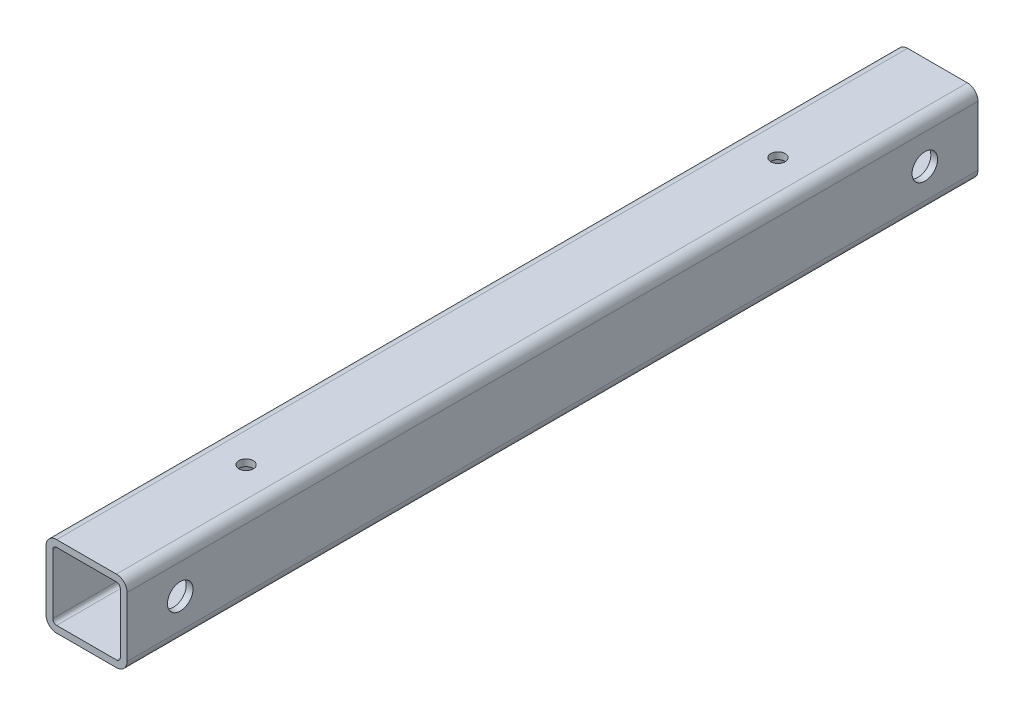
from build123d import *

# Parameters (mm, degrees)
BOSS_EXTRUDE1_DEPTH     = 400
CUT_EXTRUDE1_DEPTH      = 401.906229685
CUT_EXTRUDE1_DEPTH_BACK = 401.906229685
SKETCH2_R               = 6
CUT_EXTRUDE2_DEPTH      = 401.906229685
CUT_EXTRUDE2_DEPTH_BACK = 401.906229685
SKETCH3_R               = 3.38


with BuildPart() as part:
    # Sketch1 → Boss-Extrude1 (new body)
    with BuildSketch(Plane.XY):
        with BuildLine():
            Line((-14.05, 19.05), (14.05, 19.05))
            ThreePointArc((14.05, 19.05), (17.585533906, 17.585533906), (19.05, 14.05))
            Line((19.05, 14.05), (19.05, -14.05))
            ThreePointArc((19.05, -14.05), (17.585533906, -17.585533906), (14.05, -19.05))
            Line((14.05, -19.05), (-14.05, -19.05))
            ThreePointArc((-14.05, -19.05), (-17.585533906, -17.585533906), (-19.05, -14.05))
            Line((-19.05, -14.05), (-19.05, 14.05))
            ThreePointArc((-19.05, 14.05), (-17.585533906, 17.585533906), (-14.05, 19.05))
        make_face()
        with BuildLine():
            Line((-15.875, 14.05), (-15.875, -14.05))
            ThreePointArc((-15.875, -14.05), (-15.340469876, -15.340469876), (-14.05, -15.875))
            Line((-14.05, -15.875), (14.05, -15.875))
            ThreePointArc((14.05, -15.875), (15.340469876, -15.340469876), (15.875, -14.05))
            Line((15.875, -14.05), (15.875, 14.05))
            ThreePointArc((15.875, 14.05), (15.340469876, 15.340469876), (14.05, 15.875))
            Line((14.05, 15.875), (-14.05, 15.875))
            ThreePointArc((-14.05, 15.875), (-15.340469876, 15.340469876), (-15.875, 14.05))
        make_face(mode=Mode.SUBTRACT)
    extrude(amount=BOSS_EXTRUDE1_DEPTH)

    # Sketch2 → Cut-Extrude1 (cut, two sides: drawn at the far end of the back side and taken through both)
    with BuildSketch(Plane(origin=(0, 0, 0), x_dir=(0, 0, -1), z_dir=(1, 0, 0)).offset(-CUT_EXTRUDE1_DEPTH_BACK)):
        with Locations((-375, 0)):
            Circle(SKETCH2_R)
        with Locations((-25, 0)):
            Circle(SKETCH2_R)
    extrude(amount=CUT_EXTRUDE1_DEPTH + CUT_EXTRUDE1_DEPTH_BACK, mode=Mode.SUBTRACT)

    # Sketch3 → Cut-Extrude2 (cut, two sides: drawn at the far end of the back side and taken through both)
    with BuildSketch(Plane(origin=(0, 0, 0), x_dir=(1, 0, 0), z_dir=(0, 1, 0)).offset(-CUT_EXTRUDE2_DEPTH_BACK)):
        with Locations(Location((0, -325, 0), (0, 0, 90))):
            Circle(SKETCH3_R)
        with Locations(Location((0, -75, 0), (0, 0, 90))):
            Circle(SKETCH3_R)
    extrude(amount=CUT_EXTRUDE2_DEPTH + CUT_EXTRUDE2_DEPTH_BACK, mode=Mode.SUBTRACT)


solid = part.part
